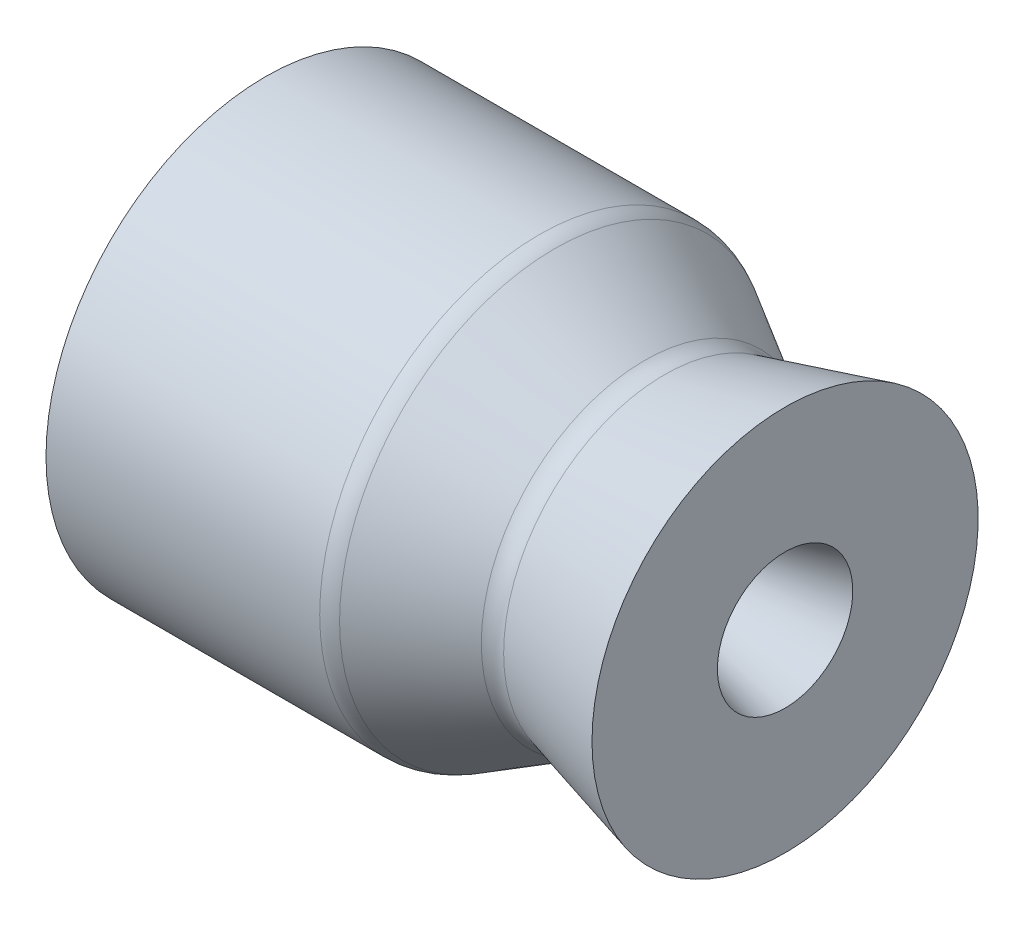
from build123d import *

# Parameters (mm, degrees)
CIRPATTERN1_COUNT = 6


with BuildPart() as part:
    # chamberNozzle → Revolve1 (revolve)
    with BuildSketch(Plane.XY, mode=Mode.PRIVATE) as revolve1_sk:
        with BuildLine():
            Line((0, 38.1), (110.897045256, 38.1))
            ThreePointArc((110.897045256, 38.1), (114.184047129, 37.667257994), (117.247045256, 36.398522628))
            Line((117.247045256, 36.398522628), (153.648338424, 15.382226219))
            ThreePointArc((153.648338424, 15.382226219), (157.542961832, 14.060179716), (161.647049978, 14.329175865))
            Line((161.647049978, 14.329175865), (210.545228126, 27.431403211))
            Line((210.545228126, 27.431403211), (210.545228126, 78.231403211))
            Line((210.545228126, 78.231403211), (161.647049978, 65.129175865))
            ThreePointArc((161.647049978, 65.129175865), (157.542961832, 64.860179716), (153.648338424, 66.182226219))
            Line((153.648338424, 66.182226219), (117.247045256, 87.198522628))
            ThreePointArc((117.247045256, 87.198522628), (114.184047129, 88.467257994), (110.897045256, 88.9))
            Line((110.897045256, 88.9), (0, 88.9))
            Line((0, 88.9), (0, 55.88))
            Line((0, 55.88), (5.08, 55.88))
            Line((5.08, 55.88), (5.08, 45.72))
            Line((5.08, 45.72), (0, 45.72))
            Line((0, 45.72), (0, 38.1))
        make_face()
    revolve(revolve1_sk.sketch.rotate(Axis((0, 0, 0), (1, 0, 0)), 90), axis=Axis((0, 0, 0), (1, 0, 0)))

    # Sketch3 → 1/2 (0.5) Diameter Hole1 (revolve, cut)
    with BuildSketch(Plane(origin=(0, 0, -72.39), x_dir=(0, 0, 1), z_dir=(0, 1, 0))):
        Polygon((0, 0), (0, 16.515464931), (6.35, 12.7), (6.35, 0.635), (6.985, 0), align=None)
    f_1_2_0_5_diameter_hole1 = revolve(axis=Axis((-6.35, 0, -72.39), (1, 0, 0)), mode=Mode.SUBTRACT)

    # CirPattern1: 1/2 (0.5) Diameter Hole1 ×6 about axis
    cirpattern1_axis = Axis((0, 0, 0), (1, 0, 0))
    for i in range(1, CIRPATTERN1_COUNT):
        add(f_1_2_0_5_diameter_hole1.rotate(cirpattern1_axis, i * 360 / CIRPATTERN1_COUNT), mode=Mode.SUBTRACT)


solid = part.part
